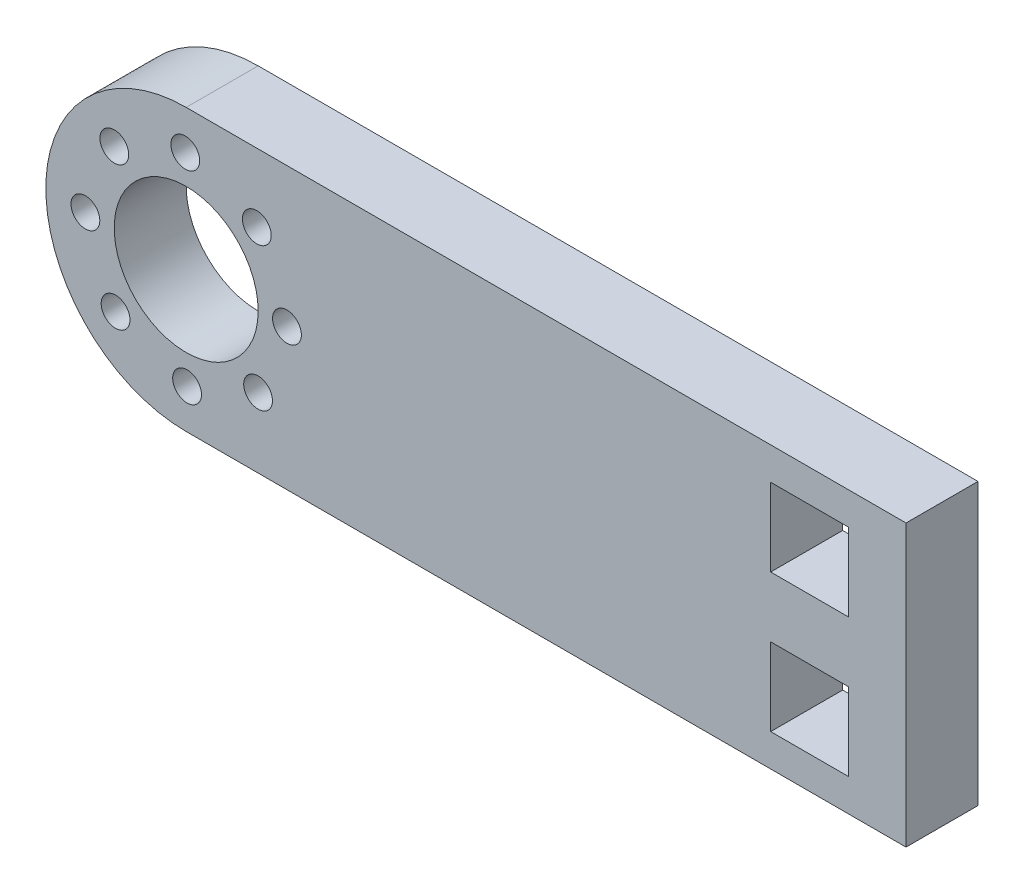
from build123d import *

# Parameters (mm, degrees)
SKETCH2_R           = 1
SKETCH2_R_2         = 5
SKETCH2_W           = 5.4
SKETCH2_H           = 5.4
BOSS_EXTRUDE1_DEPTH = 5


with BuildPart() as part:
    # Sketch2 → Boss-Extrude1 (new body)
    with BuildSketch(Plane.XY):
        with BuildLine():
            Line((-5.74908406, 12.042291654), (44.25091594, 12.042291654))
            Line((44.25091594, 12.042291654), (44.25091594, -7.457708346))
            Line((44.25091594, -7.457708346), (-5.74908406, -7.457708346))
            ThreePointArc((-5.74908406, -7.457708346), (-15.49908406, 2.292291654), (-5.74908406, 12.042291654))
        make_face()
        with Locations((-5.811538636, 9.292291654)):
            Circle(SKETCH2_R, mode=Mode.SUBTRACT)
        with Locations((-10.742794828, 7.197681829)):
            Circle(SKETCH2_R, mode=Mode.SUBTRACT)
        with Locations((-12.74908406, 2.229837079)):
            Circle(SKETCH2_R, mode=Mode.SUBTRACT)
        with Locations((-0.843693885, 7.286002421)):
            Circle(SKETCH2_R, mode=Mode.SUBTRACT)
        with Locations((1.25091594, 2.354746229)):
            Circle(SKETCH2_R, mode=Mode.SUBTRACT)
        with Locations((-0.755373293, -2.613098521)):
            Circle(SKETCH2_R, mode=Mode.SUBTRACT)
        with Locations((-5.686629485, -4.707708346)):
            Circle(SKETCH2_R, mode=Mode.SUBTRACT)
        with Locations((-10.654474236, -2.701419114)):
            Circle(SKETCH2_R, mode=Mode.SUBTRACT)
        with Locations((-5.74908406, 2.292291654)):
            Circle(SKETCH2_R_2, mode=Mode.SUBTRACT)
        with Locations((37.55091594, 7.092291654)):
            Rectangle(SKETCH2_W, SKETCH2_H, mode=Mode.SUBTRACT)
        with Locations((37.55091594, -2.507708346)):
            Rectangle(SKETCH2_W, SKETCH2_H, mode=Mode.SUBTRACT)
    extrude(amount=BOSS_EXTRUDE1_DEPTH)


solid = part.part
